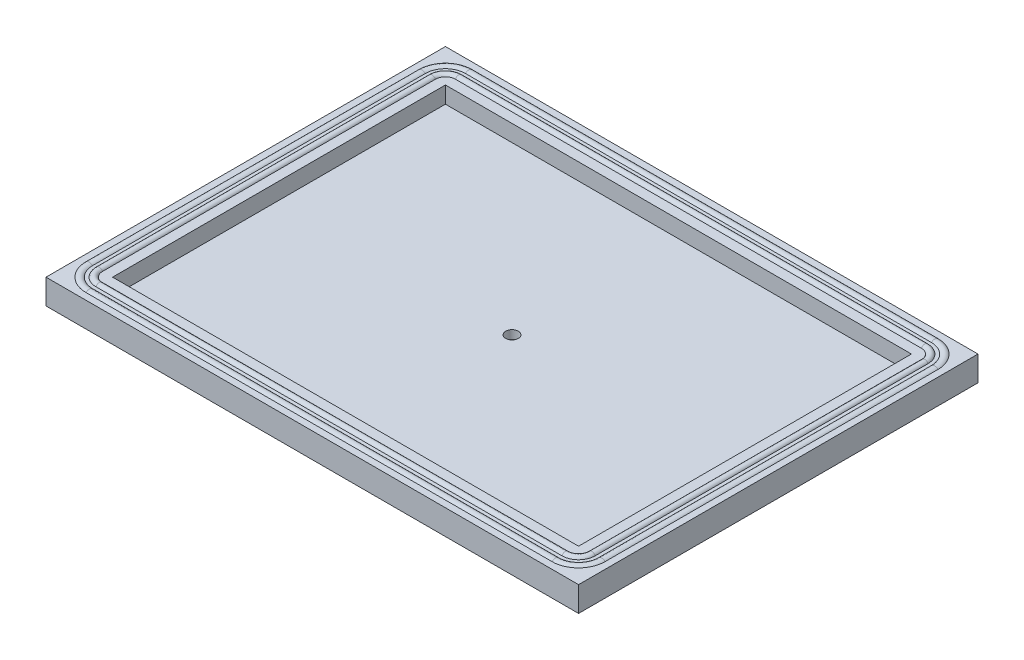
from build123d import *

# Parameters (mm, degrees)
SKETCH1_W              = 203.2
SKETCH1_H              = 152.4
MAIN_BODY_DEPTH        = 9.525
SKETCH2_W              = 177.8
SKETCH2_H              = 127
SLIDE_INSET_DEPTH      = 6.35
F_10_32_TAPPED_HOLE2_D = 4.826


with BuildPart() as part:
    # Sketch1 → main body (new body)
    with BuildSketch(Plane(origin=(0, 0, 0), x_dir=(1, 0, 0), z_dir=(0, 1, 0))):
        with Locations((173.045515995, -23.140372536)):
            Rectangle(SKETCH1_W, SKETCH1_H)
    extrude(amount=MAIN_BODY_DEPTH)

    # Sketch2 → slide inset (cut)
    with BuildSketch(Plane(origin=(0, 9.525, 0), x_dir=(1, 0, 0), z_dir=(0, 1, 0))):
        with Locations((173.045515995, -23.140372536)):
            Rectangle(SKETCH2_W, SKETCH2_H)
    extrude(amount=-SLIDE_INSET_DEPTH, mode=Mode.SUBTRACT)

    # Sweep for sealing ribs: sweep along a path in gasket bump profiles
    with BuildLine(Plane(origin=(0, 9.525, 0), x_dir=(1, 0, 0), z_dir=(0, 1, 0))) as sweep_for_sealing_ribs_path:
        Line((79.065515995, 40.359627464), (79.065515995, -86.640372536))
        ThreePointArc((79.065515995, -86.640372536), (80.553413547, -90.232474985), (84.145515995, -91.720372536))
        Line((84.145515995, -91.720372536), (261.945515995, -91.720372536))
        ThreePointArc((261.945515995, -91.720372536), (265.537618444, -90.232474985), (267.025515995, -86.640372536))
        Line((267.025515995, -86.640372536), (267.025515995, 40.359627464))
        ThreePointArc((267.025515995, 40.359627464), (265.537618444, 43.951729912), (261.945515995, 45.439627464))
        Line((261.945515995, 45.439627464), (84.145515995, 45.439627464))
        ThreePointArc((84.145515995, 45.439627464), (80.553413547, 43.951729912), (79.065515995, 40.359627464))
    # gasket bump shape → Sweep for sealing ribs (sweep)
    with BuildSketch(Plane(origin=(0, 0, 23.140372536), x_dir=(-1, 0, 0), z_dir=(0, 0, -1))):
        with BuildLine():
            Line((-77.795515995, 9.525), (-80.335515995, 9.525))
            ThreePointArc((-80.335515995, 9.525), (-79.065515995, 10.31875), (-77.795515995, 9.525))
        make_face()
        with BuildLine():
            Line((-76.525515995, 9.525), (-73.985515995, 9.525))
            ThreePointArc((-73.985515995, 9.525), (-75.255515995, 10.033), (-76.525515995, 9.525))
        make_face()
    sweep(path=sweep_for_sealing_ribs_path.line)

    # #10-32 Tapped Hole2 (through all)
    with Locations(Plane.XZ):
        with Locations((173.045515995, 23.140372536)):
            Hole(F_10_32_TAPPED_HOLE2_D / 2)


solid = part.part
